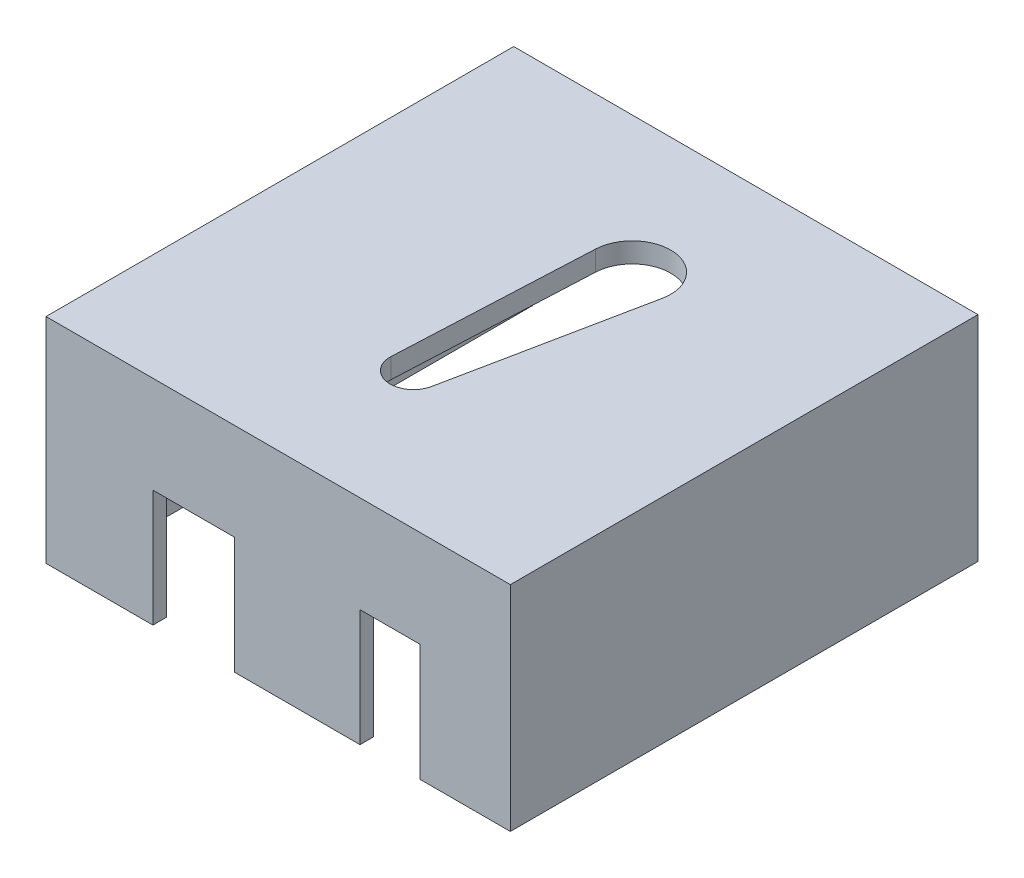
from build123d import *

# Parameters (mm, degrees)
SKETCH2_W           = 35.306
SKETCH2_H           = 71.12
BOSS_EXTRUDE1_DEPTH = 3.048
SKETCH6_W           = 35.306
SKETCH6_H           = 2.032
BOSS_EXTRUDE3_DEPTH = 29.464
SKETCH3_W           = 3.048
SKETCH3_H           = 69.088
BOSS_EXTRUDE2_DEPTH = 29.464
SKETCH4_W           = 1.016
SKETCH4_H           = 1.905
CUT_EXTRUDE1_DEPTH  = 69.088
CUT_EXTRUDE2_DEPTH  = 86.799756293
SKETCH8_W           = 12.446
SKETCH8_H           = 17.78
SKETCH8_W_2         = 9.144
CUT_EXTRUDE3_DEPTH  = 85.691766613


with BuildPart() as part:
    # Sketch2 → Boss-Extrude1 (new body)
    with BuildSketch(Plane(origin=(0, 0, 0), x_dir=(1, 0, 0), z_dir=(0, 1, 0))):
        with Locations((17.653, 35.56)):
            Rectangle(SKETCH2_W, SKETCH2_H)
    boss_extrude1 = extrude(amount=BOSS_EXTRUDE1_DEPTH)

    # Sketch6 → Boss-Extrude3 (add)
    with BuildSketch(Plane.XZ):
        with Locations((17.653, -1.016)):
            Rectangle(SKETCH6_W, SKETCH6_H)
    boss_extrude3 = extrude(amount=BOSS_EXTRUDE3_DEPTH)

    # Sketch3 → Boss-Extrude2 (add)
    with BuildSketch(Plane.XZ):
        with Locations((33.782, -36.576)):
            Rectangle(SKETCH3_W, SKETCH3_H)
    boss_extrude2 = extrude(amount=BOSS_EXTRUDE2_DEPTH)

    # Sketch4 → Cut-Extrude1 (cut)
    with BuildSketch(Plane(origin=(0, 0, -71.12), x_dir=(-1, 0, 0), z_dir=(0, 0, -1))):
        with Locations((-32.766, -10.8585)):
            Rectangle(SKETCH4_W, SKETCH4_H)
    cut_extrude1 = extrude(amount=-CUT_EXTRUDE1_DEPTH, mode=Mode.SUBTRACT)

    # Mirror1: Boss-Extrude1, Boss-Extrude3, Boss-Extrude2, Cut-Extrude1 across plane
    add(boss_extrude1.mirror(Plane(origin=(0, 3.048, 0), x_dir=(0, 0, 1), z_dir=(-1, 0, 0))))
    add(boss_extrude3.mirror(Plane(origin=(0, 3.048, 0), x_dir=(0, 0, 1), z_dir=(-1, 0, 0))))
    add(boss_extrude2.mirror(Plane(origin=(0, 3.048, 0), x_dir=(0, 0, 1), z_dir=(-1, 0, 0))))
    add(cut_extrude1.mirror(Plane(origin=(0, 3.048, 0), x_dir=(0, 0, 1), z_dir=(-1, 0, 0))), mode=Mode.SUBTRACT)

    # Sketch7 → Cut-Extrude2 (cut, through all)
    with BuildSketch(Plane(origin=(0, 3.048, 0), x_dir=(1, 0, 0), z_dir=(0, 1, 0))):
        with BuildLine():
            Line((3.230717937, 20.119567295), (9.153893754, 49.255146271))
            ThreePointArc((9.153893754, 49.255146271), (4.150548543, 56.216269331), (-2.406524046, 50.693996555))
            Line((-2.406524046, 50.693996555), (-3.806058115, 20.995389207))
            ThreePointArc((-3.806058115, 20.995389207), (-0.693203461, 17.299227364), (3.230717937, 20.119567295))
        make_face()
    extrude(amount=-CUT_EXTRUDE2_DEPTH, mode=Mode.SUBTRACT)

    # Sketch8 → Cut-Extrude3 (cut, through all)
    with BuildSketch(Plane.XY):
        with Locations((-12.827, -20.574)):
            Rectangle(SKETCH8_W, SKETCH8_H)
        with Locations((17.018, -20.574)):
            Rectangle(SKETCH8_W_2, SKETCH8_H)
    extrude(amount=-CUT_EXTRUDE3_DEPTH, mode=Mode.SUBTRACT)


solid = part.part
